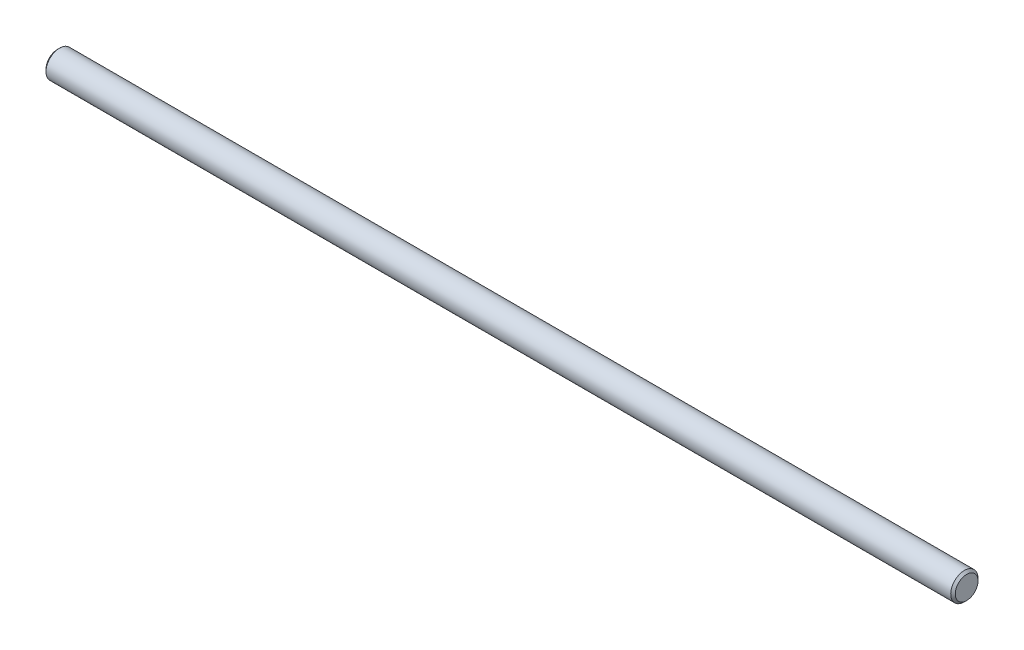
from build123d import *


with BuildPart() as part:
    # Sketch1 → Revolve1 (revolve)
    with BuildSketch(Plane(origin=(0, 0, 0), x_dir=(-1, 0, 0), z_dir=(0, 0, -1)), mode=Mode.PRIVATE) as revolve1_sk:
        Polygon((-100, 2.573090783), (-100, 0.073090783), (100, 0.073090783), (100, 2.573090783), (99.5, 3.073090783), (-99.5, 3.073090783), align=None)
    revolve(revolve1_sk.sketch.rotate(Axis((100, 0.073090783, 0), (-1, 0, 0)), 180), axis=Axis((100, 0.073090783, 0), (-1, 0, 0)))


solid = part.part
